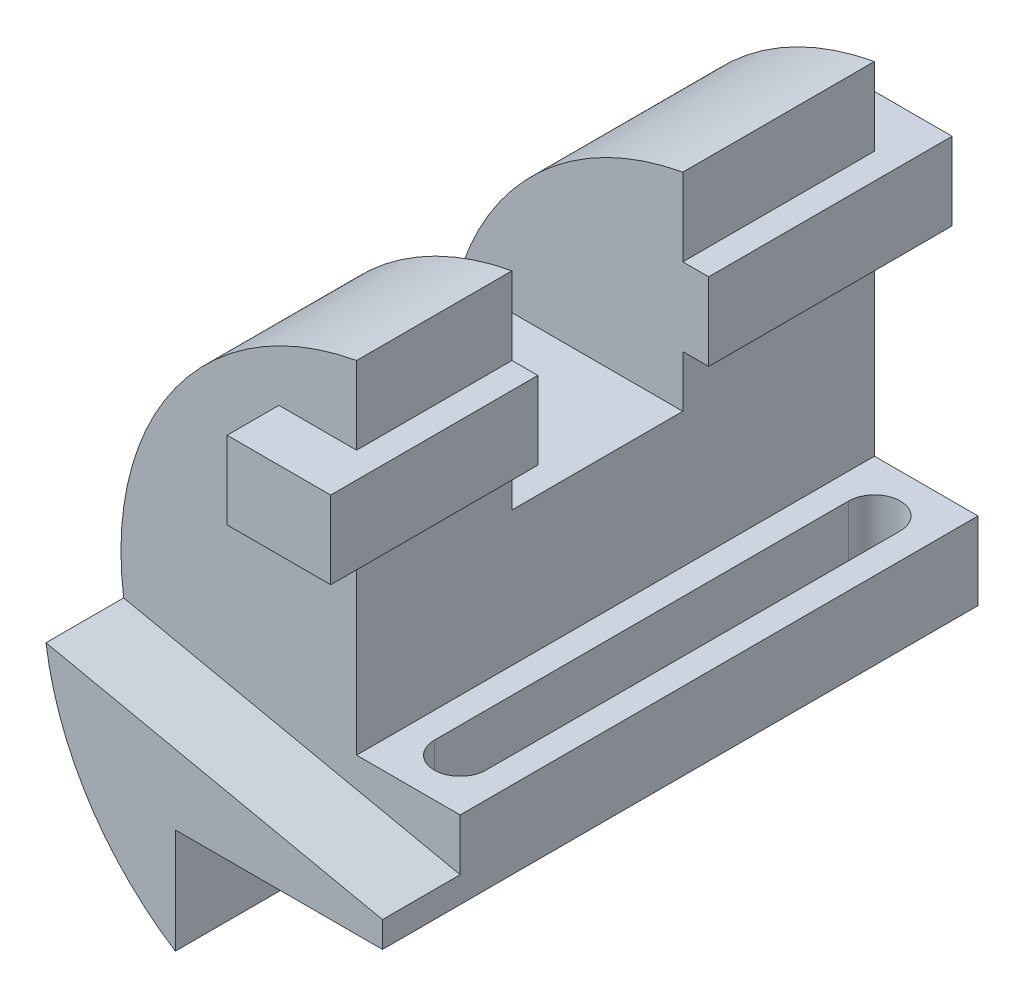
from build123d import *

# Parameters (mm, degrees)
BOSS_EXTRUDE1_DEPTH      = 115
CUT_EXTRUDE1_START       = -15
CUT_EXTRUDE1_DEPTH       = 15
BOSS_EXTRUDE3_DEPTH      = 10
BOSS_EXTRUDE3_DEPTH_BACK = 110
SKETCH3_W                = 20
SKETCH3_H                = 15
CUT_EXTRUDE3_DEPTH       = 148.83859442
CUT_EXTRUDE3_DEPTH_BACK  = 148.83859442
SKETCH4_W                = 33
SKETCH4_H                = 40
CUT_EXTRUDE4_DEPTH       = 148.88931672
CUT_EXTRUDE4_DEPTH_BACK  = 148.88931672


with BuildPart() as part:
    # Sketch1 → Boss-Extrude1 (new body)
    with BuildSketch(Plane.XY):
        with BuildLine():
            Line((0, 0), (-40, 0))
            Line((-40, 0), (-40, -20.284813279))
            ThreePointArc((-40, -20.284813279), (-64.44863038, 37.159922212), (-20, 81))
            Line((-20, 81), (-20, 15))
            Line((-20, 15), (0, 15))
            Line((0, 15), (0, 0))
        make_face()
    extrude(amount=BOSS_EXTRUDE1_DEPTH)

    # Sketch2 → Cut-Extrude1 (cut)
    with BuildSketch(Plane.XY.offset(115).offset(CUT_EXTRUDE1_START)):
        with BuildLine():
            Line((0, 5), (-64.977603037, 18.811415887))
            ThreePointArc((-64.977603037, 18.811415887), (-54.970848586, 58.933290194), (-20, 81))
            Line((-20, 81), (-20, 15))
            Line((-20, 15), (0, 15))
            Line((0, 15), (0, 5))
        make_face()
    extrude(amount=CUT_EXTRUDE1_DEPTH, mode=Mode.SUBTRACT)

    # Sketch3 → Boss-Extrude3 (add, two sides: drawn at the far end of the back side and taken through both)
    with BuildSketch(Plane(origin=(0, 0, 0), x_dir=(-1, 0, 0), z_dir=(0, 0, -1)).offset(-BOSS_EXTRUDE3_DEPTH_BACK)):
        with Locations((25, 58.5)):
            Rectangle(SKETCH3_W, SKETCH3_H)
    extrude(amount=BOSS_EXTRUDE3_DEPTH + BOSS_EXTRUDE3_DEPTH_BACK)

    # Sketch4 → Cut-Extrude3 (cut, two sides: drawn at the far end of the back side and taken through both)
    with BuildSketch(Plane(origin=(-20, 0, 0), x_dir=(0, 0, -1), z_dir=(1, 0, 0)).offset(-CUT_EXTRUDE3_DEPTH_BACK)):
        with Locations((-53.5, 61)):
            Rectangle(SKETCH4_W, SKETCH4_H)
    extrude(amount=CUT_EXTRUDE3_DEPTH + CUT_EXTRUDE3_DEPTH_BACK, mode=Mode.SUBTRACT)

    # Sketch5 → Cut-Extrude4 (cut, two sides: drawn at the far end of the back side and taken through both)
    with BuildSketch(Plane(origin=(0, 15, 0), x_dir=(1, 0, 0), z_dir=(0, 1, 0)).offset(-CUT_EXTRUDE4_DEPTH_BACK)):
        with BuildLine():
            Line((-5, -10), (-5, -90))
            ThreePointArc((-5, -90), (-10, -95), (-15, -90))
            Line((-15, -90), (-15, -10))
            ThreePointArc((-15, -10), (-10, -5), (-5, -10))
        make_face()
    extrude(amount=CUT_EXTRUDE4_DEPTH + CUT_EXTRUDE4_DEPTH_BACK, mode=Mode.SUBTRACT)


solid = part.part
